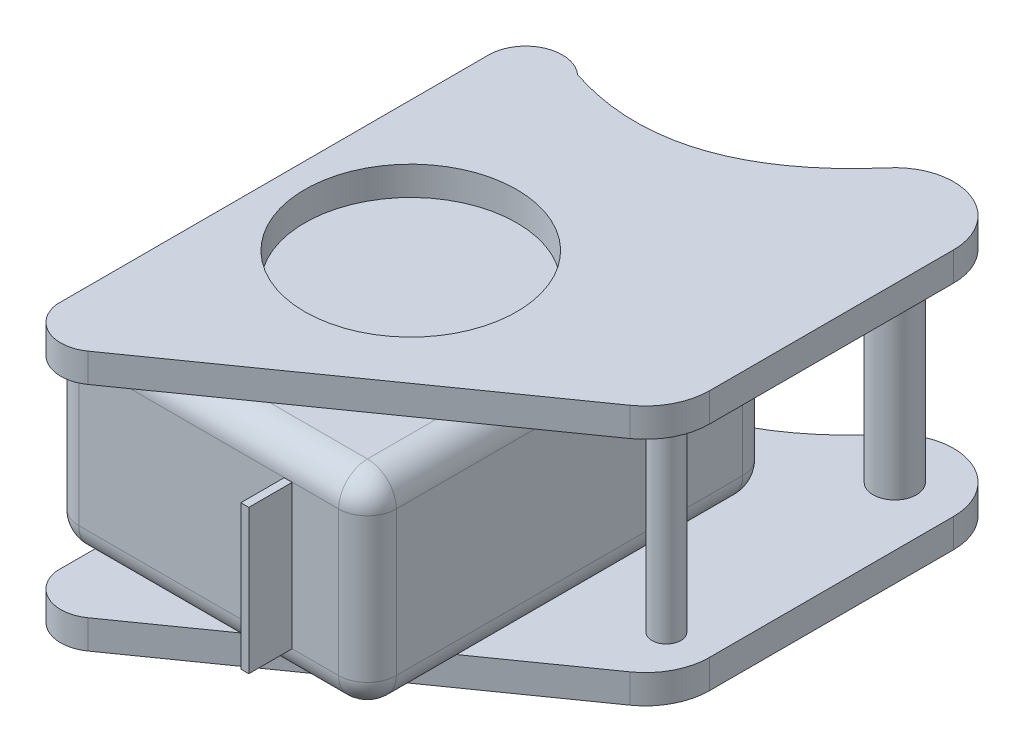
from build123d import *

# Parameters (mm, degrees)
SKETCH1_W                = 22
SKETCH1_H                = 14
BOSS_EXTRUDE1_DEPTH      = 14
FILLET1_R                = 2
SKETCH2_R                = 1
CUT_EXTRUDE1_DEPTH       = 19
BOSS_EXTRUDE2_DEPTH      = 3
BOSS_EXTRUDE2_DEPTH_BACK = 31
SKETCH3_W                = 0.554521252
SKETCH3_H                = 9.98669991
SKETCH4_R                = 2
SKETCH4_R_2              = 1.5
BOSS_EXTRUDE3_DEPTH      = 0.8
CUT_EXTRUDE2_START       = -10
SKETCH4_2_R              = 1.5
CUT_EXTRUDE2_DEPTH       = 10
SKETCH5_R                = 7.185985437
BOSS_EXTRUDE5_DEPTH      = 2
BOSS_EXTRUDE6_START      = 2
SKETCH6_R                = 7.341706918
BOSS_EXTRUDE6_DEPTH      = 2
SKETCH7_R                = 1.5
BOSS_EXTRUDE7_DEPTH      = 14
SKETCH8_R                = 1
BOSS_EXTRUDE8_DEPTH      = 14


with BuildPart() as part:
    # Sketch1 → Boss-Extrude1 (new, symmetric)
    with BuildSketch(Plane.XY):
        Rectangle(SKETCH1_W, SKETCH1_H)
    extrude(amount=BOSS_EXTRUDE1_DEPTH, both=True)

    # Fillet1
    fillet1_edges = [part.edges().sort_by_distance(p)[0] for p in [
        (-11, 0, 14),
        (0, -7, 14),
        (11, 0, 14),
        (0, -7, -14),
        (-11, 0, -14),
        (0, 7, -14),
        (11, 0, -14),
        (0, 7, 14),
        (11, -7, 0),
        (-11, -7, 0),
        (-11, 7, 0),
        (11, 7, 0),
    ]]
    fillet(fillet1_edges, radius=FILLET1_R)

    # Sketch2 → Cut-Extrude1 (cut)
    with BuildSketch(Plane.ZY.offset(11)):
        with Locations((-10.565380275, 3.689151377)):
            Circle(SKETCH2_R)
        with Locations((10.5, 3.689151377)):
            Circle(SKETCH2_R)
        with Locations((10.5, -3.4271998)):
            Circle(SKETCH2_R)
        with Locations((-10.565380275, -3.4271998)):
            Circle(SKETCH2_R)
    extrude(amount=-CUT_EXTRUDE1_DEPTH, mode=Mode.SUBTRACT)

    # Sketch3 → Boss-Extrude2 (add, two sides: drawn at the far end of the back side and taken through both)
    with BuildSketch(Plane(origin=(0, 0, -14), x_dir=(-1, 0, 0), z_dir=(0, 0, -1)).offset(-BOSS_EXTRUDE2_DEPTH_BACK)):
        with Locations((-5.504015561, -0.006650045)):
            Rectangle(SKETCH3_W, SKETCH3_H)
    extrude(amount=BOSS_EXTRUDE2_DEPTH + BOSS_EXTRUDE2_DEPTH_BACK)

    # Sketch4 → Boss-Extrude3 (add)
    with BuildSketch(Plane.ZY.offset(11)):
        with Locations(Location((5.416543399, 0, 0), (0, 0, 180))):
            Circle(SKETCH4_R)
        with Locations((5.416543399, 0)):
            Circle(SKETCH4_R_2, mode=Mode.SUBTRACT)
    extrude(amount=BOSS_EXTRUDE3_DEPTH)

    # Sketch4<2> → Cut-Extrude2 (cut)
    with BuildSketch(Plane.ZY.offset(11).offset(CUT_EXTRUDE2_START)):
        with Locations((5.416543399, 0)):
            Circle(SKETCH4_2_R)
    extrude(amount=CUT_EXTRUDE2_DEPTH, mode=Mode.SUBTRACT)

    # Sketch5 → Boss-Extrude5 (add)
    # profile 1 of 2: a face of its own
    with BuildSketch(Plane.XZ.offset(7)):
        with BuildLine():
            Line((2.238059124, 12), (-5.155279816, 17.212901612))
            ThreePointArc((-5.155279816, 17.212901612), (-7.581820377, 17.456866553), (-9.044402043, 15.505335653))
            Line((-9.044402043, 15.505335653), (-9.044402043, 14.86603547))
            Line((-9.044402043, 14.86603547), (-9.044402043, -14.449829967))
            ThreePointArc((-9.044402043, -14.449829967), (-7.529616483, -16.780632089), (-4.78450574, -16.342932608))
            add(Edge.make_bspline(
                [(-4.78450574, -16.342932608), (1.340585112, -14.306096739), (6.77146781, -16.003800215), (11.508142355, -21.436043034)],
                knots=[0.084300371, 0.084300371, 0.084300371, 0.084300371, 1, 1, 1, 1], degree=3))
            ThreePointArc((11.508142355, -21.436043034), (16.041717565, -22.709236327), (18.758055645, -18.862701162))
            Line((18.758055645, -18.862701162), (18.758055645, -1.957446637))
            ThreePointArc((18.758055645, -1.957446637), (18.258122382, 0.092853884), (16.870544719, 1.682914803))
            Line((16.870544719, 1.682914803), (9, 7.232285064))
            Line((9, 7.232285064), (9, -12))
            Line((9, -12), (-9, -12))
            Line((-9, -12), (-9, 12))
            Line((-9, 12), (2.238059124, 12))
        make_face()
    # profile 2 of 2: a face of its own
    with BuildSketch(Plane.XZ.offset(7)):
        Polygon((9, 7.232285064), (2.238059124, 12), (-9, 12), (-9, -12), (9, -12), align=None)
        with Locations(Location((0, 0, 0), (0, 0, 270))):
            Circle(SKETCH5_R, mode=Mode.SUBTRACT)
    extrude(amount=BOSS_EXTRUDE5_DEPTH)

    # Sketch6 → Boss-Extrude6 (add)
    with BuildSketch(Plane(origin=(0, 7, 0), x_dir=(1, 0, 0), z_dir=(0, 1, 0)).offset(BOSS_EXTRUDE6_START)):
        with BuildLine():
            Line((-5.155279816, -17.212901612), (16.870544719, -1.682914803))
            ThreePointArc((16.870544719, -1.682914803), (18.258122382, -0.092853884), (18.758055645, 1.957446637))
            Line((18.758055645, 1.957446637), (18.758055645, 18.862701162))
            ThreePointArc((18.758055645, 18.862701162), (16.041717554, 22.709236331), (11.50814234, 21.436043017))
            add(Edge.make_bspline(
                [(11.50814234, 21.436043017), (4.403130528, 13.287678808), (-4.78450574, 16.342932608)],
                knots=[0, 0, 0, 1, 1, 1], degree=2))
            ThreePointArc((-4.78450574, 16.342932608), (-7.529616483, 16.780632089), (-9.044402043, 14.449829967))
            Line((-9.044402043, 14.449829967), (-9.044402043, -15.505335653))
            ThreePointArc((-9.044402043, -15.505335653), (-7.581820377, -17.456866553), (-5.155279816, -17.212901612))
        make_face()
        with Locations(Location((0, 0, 0), (0, 0, 270))):
            Circle(SKETCH6_R, mode=Mode.SUBTRACT)
    extrude(amount=-BOSS_EXTRUDE6_DEPTH)

    # Sketch7 → Boss-Extrude7 (add)
    with BuildSketch(Plane(origin=(0, -7, 0), x_dir=(1, 0, 0), z_dir=(0, 1, 0))):
        with Locations(Location((14.676397787, 18.862701162, 0), (0, 0, 90))):
            Circle(SKETCH7_R)
    extrude(amount=BOSS_EXTRUDE7_DEPTH)

    # Sketch8 → Boss-Extrude8 (add)
    with BuildSketch(Plane.XZ.offset(-7)):
        with Locations(Location((15.758055645, -1.957446637, 0), (0, 0, 90))):
            Circle(SKETCH8_R)
    extrude(amount=BOSS_EXTRUDE8_DEPTH)


solid = part.part
